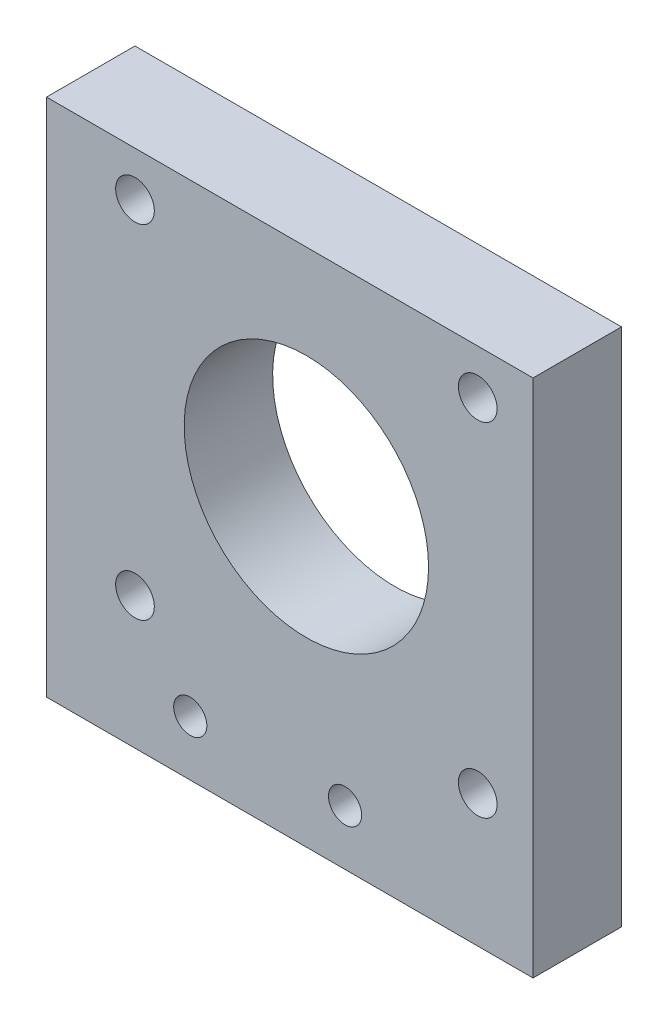
from build123d import *

# Parameters (mm, degrees)
SKETCH_1_W          = 8
SKETCH_1_H          = 47
EXTRUDE_1_DEPTH     = 44
CUT_EXTRUDE_1_REACH = 61.141
SKETCH_2_R          = 11.05
SKETCH_2_R_2        = 1.75
SKETCH_2_R_3        = 1.5
SKETCH_6_R          = 3
CUT_EXTRUDE_3_DEPTH = 4


with BuildPart() as part:
    # 草图1 → 凸台-拉伸1 (new body)
    with BuildSketch(Plane(origin=(0, 0, 0), x_dir=(0, 0, -1), z_dir=(1, 0, 0))):
        with Locations((-0.573456279, 15.2)):
            Rectangle(SKETCH_1_W, SKETCH_1_H)
    extrude(amount=-EXTRUDE_1_DEPTH)

    # 草图2 → 切除-拉伸1 (cut, up to next)
    with BuildSketch(Plane(origin=(0, 0, -3.426543721), x_dir=(-1, 0, 0), z_dir=(0, 0, -1)), mode=Mode.PRIVATE) as cut_extrude_1_sk1:
        with Locations(Location((20.5, 19.159060435, 0), (0, 0, 90))):
            Circle(SKETCH_2_R)
    cut_extrude_1_tool1 = extrude(cut_extrude_1_sk1.sketch, amount=-CUT_EXTRUDE_1_REACH, mode=Mode.PRIVATE) & part.part
    # 草图2 → 切除-拉伸1 (cut, up to next)
    with BuildSketch(Plane(origin=(0, 0, -3.426543721), x_dir=(-1, 0, 0), z_dir=(0, 0, -1)), mode=Mode.PRIVATE) as cut_extrude_1_sk2:
        with Locations(Location((5, 34.659060435, 0), (0, 0, 90))):
            Circle(SKETCH_2_R_2)
    cut_extrude_1_tool2 = extrude(cut_extrude_1_sk2.sketch, amount=-CUT_EXTRUDE_1_REACH, mode=Mode.PRIVATE) & part.part
    # 草图2 → 切除-拉伸1 (cut, up to next)
    with BuildSketch(Plane(origin=(0, 0, -3.426543721), x_dir=(-1, 0, 0), z_dir=(0, 0, -1)), mode=Mode.PRIVATE) as cut_extrude_1_sk3:
        with Locations(Location((5, 3.659060435, 0), (0, 0, 90))):
            Circle(SKETCH_2_R_2)
    cut_extrude_1_tool3 = extrude(cut_extrude_1_sk3.sketch, amount=-CUT_EXTRUDE_1_REACH, mode=Mode.PRIVATE) & part.part
    # 草图2 → 切除-拉伸1 (cut, up to next)
    with BuildSketch(Plane(origin=(0, 0, -3.426543721), x_dir=(-1, 0, 0), z_dir=(0, 0, -1)), mode=Mode.PRIVATE) as cut_extrude_1_sk4:
        with Locations(Location((36, 3.659060435, 0), (0, 0, 90))):
            Circle(SKETCH_2_R_2)
    cut_extrude_1_tool4 = extrude(cut_extrude_1_sk4.sketch, amount=-CUT_EXTRUDE_1_REACH, mode=Mode.PRIVATE) & part.part
    # 草图2 → 切除-拉伸1 (cut, up to next)
    with BuildSketch(Plane(origin=(0, 0, -3.426543721), x_dir=(-1, 0, 0), z_dir=(0, 0, -1)), mode=Mode.PRIVATE) as cut_extrude_1_sk5:
        with Locations(Location((36, 34.659060435, 0), (0, 0, 90))):
            Circle(SKETCH_2_R_2)
    cut_extrude_1_tool5 = extrude(cut_extrude_1_sk5.sketch, amount=-CUT_EXTRUDE_1_REACH, mode=Mode.PRIVATE) & part.part
    # 草图2 → 切除-拉伸1 (cut, up to next)
    with BuildSketch(Plane(origin=(0, 0, -3.426543721), x_dir=(-1, 0, 0), z_dir=(0, 0, -1)), mode=Mode.PRIVATE) as cut_extrude_1_sk6:
        with Locations(Location((17, -3.3, 0), (0, 0, 90))):
            Circle(SKETCH_2_R_3)
    cut_extrude_1_tool6 = extrude(cut_extrude_1_sk6.sketch, amount=-CUT_EXTRUDE_1_REACH, mode=Mode.PRIVATE) & part.part
    # 草图2 → 切除-拉伸1 (cut, up to next)
    with BuildSketch(Plane(origin=(0, 0, -3.426543721), x_dir=(-1, 0, 0), z_dir=(0, 0, -1)), mode=Mode.PRIVATE) as cut_extrude_1_sk7:
        with Locations(Location((31, -3.3, 0), (0, 0, 90))):
            Circle(SKETCH_2_R_3)
    cut_extrude_1_tool7 = extrude(cut_extrude_1_sk7.sketch, amount=-CUT_EXTRUDE_1_REACH, mode=Mode.PRIVATE) & part.part
    add(cut_extrude_1_tool1.solids().sort_by_distance((-20.5, 19.15906, -3.426544))[0], mode=Mode.SUBTRACT)
    add(cut_extrude_1_tool2.solids().sort_by_distance((-5, 34.65906, -3.426544))[0], mode=Mode.SUBTRACT)
    add(cut_extrude_1_tool3.solids().sort_by_distance((-5, 3.65906, -3.426544))[0], mode=Mode.SUBTRACT)
    add(cut_extrude_1_tool4.solids().sort_by_distance((-36, 3.65906, -3.426544))[0], mode=Mode.SUBTRACT)
    add(cut_extrude_1_tool5.solids().sort_by_distance((-36, 34.65906, -3.426544))[0], mode=Mode.SUBTRACT)
    add(cut_extrude_1_tool6.solids().sort_by_distance((-17, -3.3, -3.426544))[0], mode=Mode.SUBTRACT)
    add(cut_extrude_1_tool7.solids().sort_by_distance((-31, -3.3, -3.426544))[0], mode=Mode.SUBTRACT)

    # 草图6 → 切除-拉伸3 (cut)
    with BuildSketch(Plane(origin=(0, 0, -3.426543721), x_dir=(-1, 0, 0), z_dir=(0, 0, -1))):
        with Locations(Location((17, -3.3, 0), (0, 0, 90))):
            Circle(SKETCH_6_R)
        with Locations(Location((31, -3.3, 0), (0, 0, 90))):
            Circle(SKETCH_6_R)
    extrude(amount=-CUT_EXTRUDE_3_DEPTH, mode=Mode.SUBTRACT)


solid = part.part
